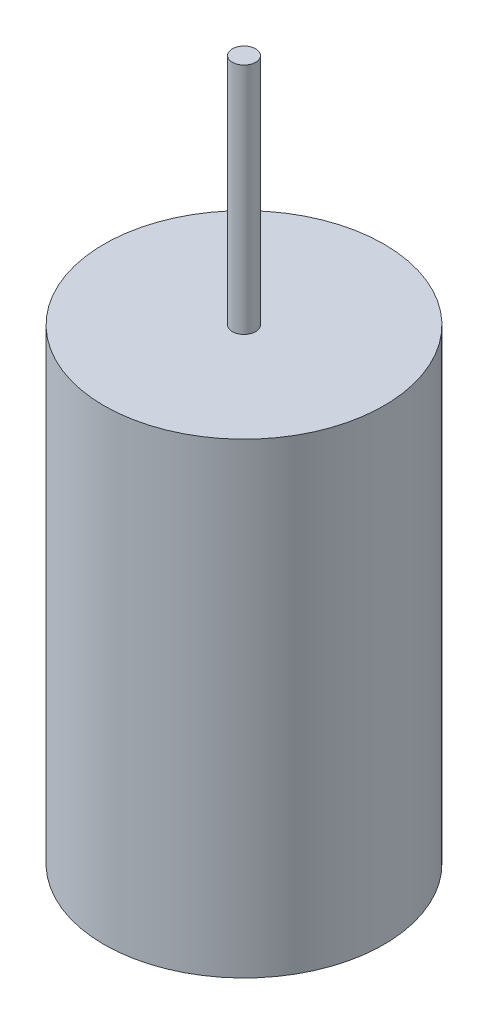
from build123d import *

# Parameters (mm, degrees)
SKETCH1_R           = 3
BOSS_EXTRUDE1_DEPTH = 10
SKETCH2_R           = 0.25
BOSS_EXTRUDE2_DEPTH = 5


with BuildPart() as part:
    # Sketch1 → Boss-Extrude1 (new body)
    with BuildSketch(Plane(origin=(0, 0, 0), x_dir=(1, 0, 0), z_dir=(0, 1, 0))):
        with Locations(Location((0, 0, 0), (0, 0, 270))):
            Circle(SKETCH1_R)
    extrude(amount=BOSS_EXTRUDE1_DEPTH)

    # Sketch2 → Boss-Extrude2 (add)
    with BuildSketch(Plane(origin=(0, 10, 0), x_dir=(1, 0, 0), z_dir=(0, 1, 0))):
        with Locations(Location((0, 0, 0), (0, 0, 270))):
            Circle(SKETCH2_R)
    extrude(amount=BOSS_EXTRUDE2_DEPTH)


solid = part.part
